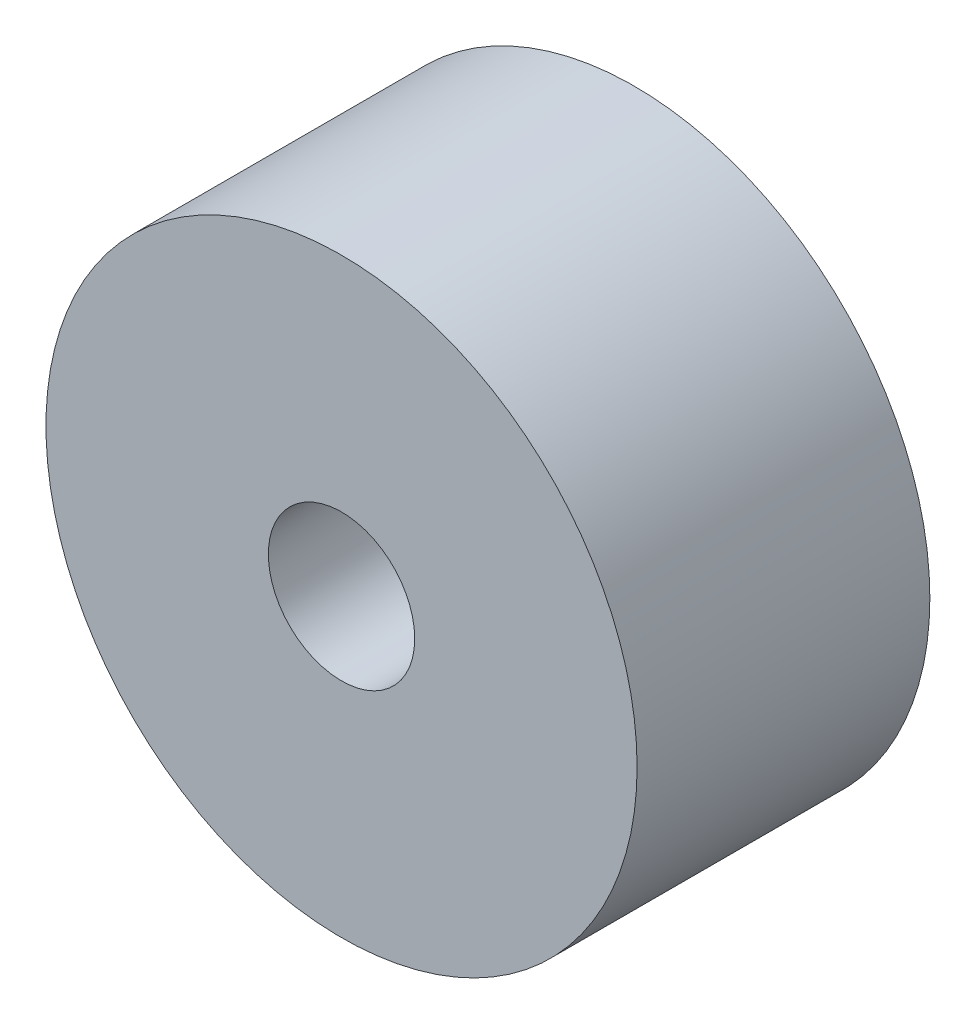
from build123d import *

# Parameters (mm, degrees)
CARRIER_START = -20
SKETCH_1_R    = 40.384615385
SKETCH_1_R_2  = 10
CARRIER_DEPTH = 40


with BuildPart() as part:
    # Эскиз1 → Carrier (new body)
    with BuildSketch(Plane.XY.offset(CARRIER_START)):
        Circle(SKETCH_1_R)
        Circle(SKETCH_1_R_2, mode=Mode.SUBTRACT)
    extrude(amount=CARRIER_DEPTH)


solid = part.part
